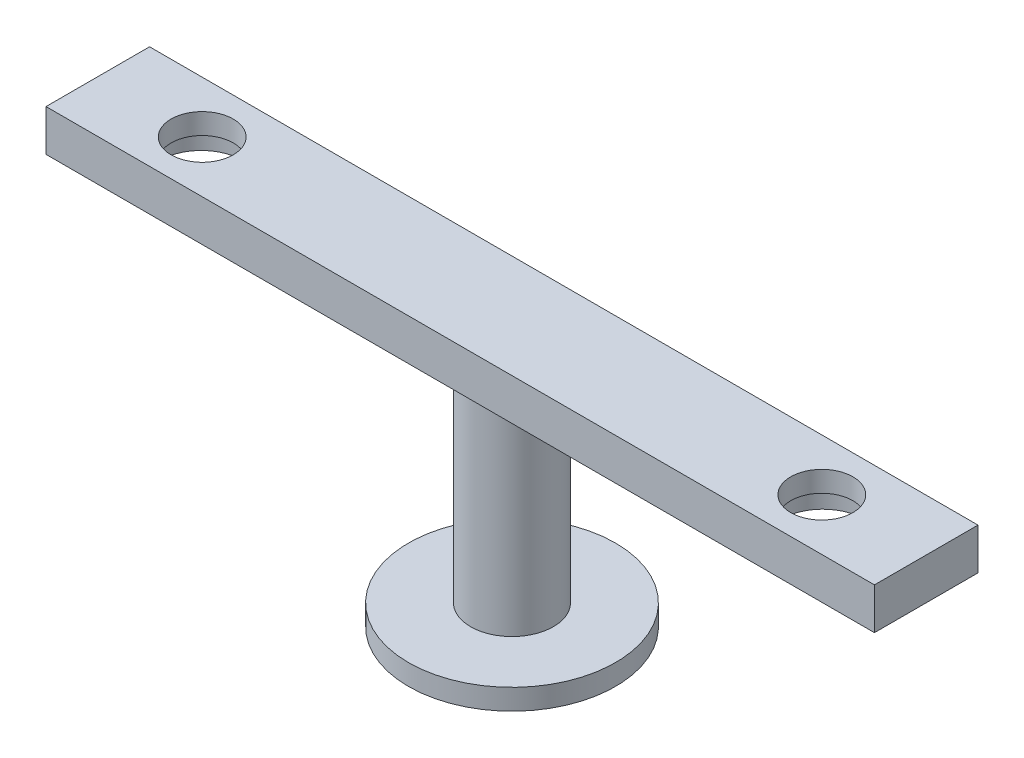
from build123d import *

# Parameters (mm, degrees)
SKETCH2_R           = 5
BOSS_EXTRUDE1_DEPTH = 1
SKETCH3_R           = 2.5
SKETCH3_R_2         = 1.75
BOSS_EXTRUDE2_DEPTH = 0.5
SKETCH4_R           = 2
BOSS_EXTRUDE3_DEPTH = 10
SKETCH6_W           = 40
SKETCH6_H           = 5
BOSS_EXTRUDE4_DEPTH = 2
SKETCH9_R           = 2
CUT_EXTRUDE1_DEPTH  = 1
SKETCH10_R          = 1.5
CUT_EXTRUDE2_DEPTH  = 31


with BuildPart() as part:
    # Sketch2 → Boss-Extrude1 (new body)
    with BuildSketch(Plane(origin=(0, 0, 0), x_dir=(-1, 0, 0), z_dir=(0, 1, 0))):
        with Locations(Location((0, 0, 0), (0, 0, 90))):
            Circle(SKETCH2_R)
    extrude(amount=BOSS_EXTRUDE1_DEPTH)

    # Sketch3 → Boss-Extrude2 (add)
    with BuildSketch(Plane.XZ):
        with Locations(Location((0, 0, 0), (0, 0, 90))):
            Circle(SKETCH3_R)
        with Locations(Location((0, 0, 0), (0, 0, 270))):
            Circle(SKETCH3_R_2, mode=Mode.SUBTRACT)
    extrude(amount=BOSS_EXTRUDE2_DEPTH)

    # Sketch4 → Boss-Extrude3 (add)
    with BuildSketch(Plane(origin=(0, 1, 0), x_dir=(-1, 0, 0), z_dir=(0, 1, 0))):
        with Locations(Location((0, 0, 0), (0, 0, 90))):
            Circle(SKETCH4_R)
    extrude(amount=BOSS_EXTRUDE3_DEPTH)

    # Sketch6 → Boss-Extrude4 (add)
    with BuildSketch(Plane(origin=(0, 11, 0), x_dir=(-1, 0, 0), z_dir=(0, 1, 0))):
        Rectangle(SKETCH6_W, SKETCH6_H)
    extrude(amount=BOSS_EXTRUDE4_DEPTH)

    # Sketch9 → Cut-Extrude1 (cut)
    with BuildSketch(Plane.XZ.offset(-11)):
        with Locations(Location((-15, 0, 0), (0, 0, 270))):
            Circle(SKETCH9_R)
        with Locations(Location((15, 0, 0), (0, 0, 90))):
            Circle(SKETCH9_R)
    extrude(amount=-CUT_EXTRUDE1_DEPTH, mode=Mode.SUBTRACT)

    # Sketch10 → Cut-Extrude2 (cut)
    with BuildSketch(Plane.XZ.offset(-12)):
        with Locations(Location((-14.9595974, 0, 0), (0, 0, 270))):
            Circle(SKETCH10_R)
        with Locations(Location((14.9595974, 0, 0), (0, 0, 90))):
            Circle(SKETCH10_R)
    extrude(amount=-CUT_EXTRUDE2_DEPTH, mode=Mode.SUBTRACT)


solid = part.part
